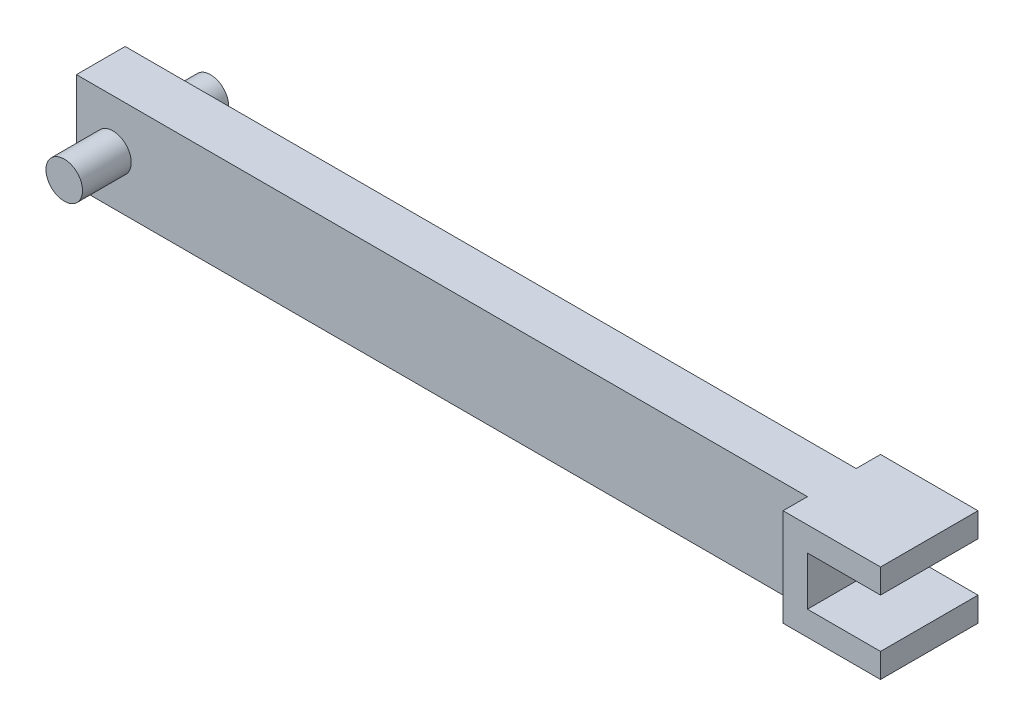
from build123d import *

# Parameters (mm, degrees)
SKETCH1_W           = 300
SKETCH1_H           = 40
BOSS_EXTRUDE1_DEPTH = 10
SKETCH2_R           = 7.5
BOSS_EXTRUDE2_DEPTH = 30
SKETCH3_W           = 40
SKETCH3_H           = 40
BOSS_EXTRUDE3_DEPTH = 40
SKETCH4_W           = 60
SKETCH4_H           = 20
CUT_EXTRUDE1_DEPTH  = 58


with BuildPart() as part:
    # Sketch1 → Boss-Extrude1 (new, symmetric)
    with BuildSketch(Plane.XY):
        Rectangle(SKETCH1_W, SKETCH1_H)
    extrude(amount=BOSS_EXTRUDE1_DEPTH, both=True)

    # Sketch2 → Boss-Extrude2 (add, symmetric)
    with BuildSketch(Plane.XY):
        with Locations((-135, 0)):
            Circle(SKETCH2_R)
    extrude(amount=BOSS_EXTRUDE2_DEPTH, both=True)

    # Sketch3 → Boss-Extrude3 (add)
    with BuildSketch(Plane(origin=(150, 0, 0), x_dir=(0, 0, -1), z_dir=(1, 0, 0))):
        Rectangle(SKETCH3_W, SKETCH3_H)
    extrude(amount=BOSS_EXTRUDE3_DEPTH)

    # Sketch4 → Cut-Extrude1 (cut)
    with BuildSketch(Plane.XY.offset(20)):
        with Locations((190, 0)):
            Rectangle(SKETCH4_W, SKETCH4_H)
    extrude(amount=-CUT_EXTRUDE1_DEPTH, mode=Mode.SUBTRACT)


solid = part.part
